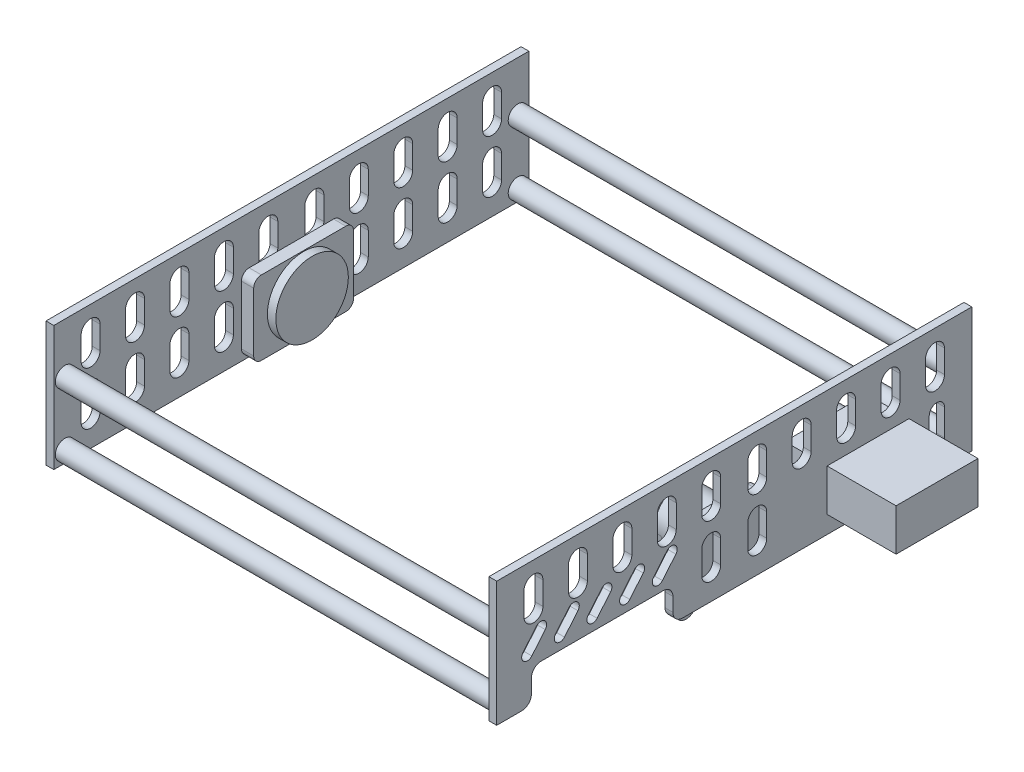
from build123d import *
from build123d.topology import SkipClean

# Parameters (mm, degrees)
SKETCH1_R             = 2.5019
BOSS_EXTRUDE1_DEPTH   = 115.316
BOSS_EXTRUDE1_2_DEPTH = 115.316
BOSS_EXTRUDE1_3_DEPTH = 115.316
BOSS_EXTRUDE1_4_DEPTH = 115.316
SKETCH5_W             = 123.698
SKETCH5_H             = 32.512
BOSS_EXTRUDE3_DEPTH   = 2.032
SKETCH6_W             = 21.329640996
SKETCH6_H             = 10.922
BOSS_EXTRUDE4_DEPTH   = 2.032
CUT_EXTRUDE1_DEPTH    = 2.032
BOSS_EXTRUDE5_DEPTH   = 3
SKETCH9_R             = 6.644818813
BOSS_EXTRUDE6_DEPTH   = 9
BOSS_EXTRUDE7_DEPTH   = 1.5
BOSS_EXTRUDE8_DEPTH   = 10.922
SKETCH13_R            = 4
BOSS_EXTRUDE9_DEPTH   = 0.7
SKETCH15_R            = 3.25
BOSS_EXTRUDE10_DEPTH  = 3.7
BOSS_EXTRUDE11_DEPTH  = 1.2
BOSS_EXTRUDE12_DEPTH  = 3.2
SKETCH17_R            = 9.44065
BOSS_EXTRUDE13_DEPTH  = 2.2


with BuildPart() as part:
    # Sketch1 → Boss-Extrude1 (new body)
    with BuildSketch(Plane(origin=(0, 0, 0), x_dir=(0, 0, -1), z_dir=(1, 0, 0))):
        with Locations(Location((0, 0, 0), (0, 0, 180))):
            Circle(SKETCH1_R)
    extrude(amount=BOSS_EXTRUDE1_DEPTH)



with BuildPart() as body_2:
    # Sketch1 → Boss-Extrude1 2 (new body)
    with BuildSketch(Plane(origin=(0, 0, 0), x_dir=(0, 0, -1), z_dir=(1, 0, 0))):
        with Locations(Location((0, -16.4338, 0), (0, 0, 180))):
            Circle(SKETCH1_R)
    extrude(amount=BOSS_EXTRUDE1_2_DEPTH)


with BuildPart() as body_3:
    # Sketch1 → Boss-Extrude1 3 (new body)
    with BuildSketch(Plane(origin=(0, 0, 0), x_dir=(0, 0, -1), z_dir=(1, 0, 0))):
        with Locations(Location((117.9322, -16.4338, 0), (0, 0, 180))):
            Circle(SKETCH1_R)
    extrude(amount=BOSS_EXTRUDE1_3_DEPTH)


with BuildPart() as body_4:
    # Sketch1 → Boss-Extrude1 4 (new body)
    with BuildSketch(Plane(origin=(0, 0, 0), x_dir=(0, 0, -1), z_dir=(1, 0, 0))):
        with Locations(Location((117.9322, 0, 0), (0, 0, 180))):
            Circle(SKETCH1_R)
    extrude(amount=BOSS_EXTRUDE1_4_DEPTH)


with BuildPart() as part_1:
    add(part.part)

    add(body_2.part)  # Boss-Extrude3 merges body 2

    add(body_3.part)  # Boss-Extrude3 merges body 3

    add(body_4.part)  # Boss-Extrude3 merges body 4
    # Sketch5 → Boss-Extrude3 (add)
    with BuildSketch(Plane(origin=(0, 0, 0), x_dir=(0, 0, -1), z_dir=(1, 0, 0))):
        with Locations((58.9661, -3.302)):
            Rectangle(SKETCH5_W, SKETCH5_H)
        with BuildLine():
            Line((67.4231, 1.2458), (67.4231, 7.2378))
            ThreePointArc((67.4231, 7.2378), (64.9581, 9.7028), (62.4931, 7.2378))
            Line((62.4931, 7.2378), (62.4931, 1.2458))
            ThreePointArc((62.4931, 1.2458), (64.9581, -1.2192), (67.4231, 1.2458))
        make_face(mode=Mode.SUBTRACT)
        with BuildLine():
            Line((67.4231, -12.5337), (67.4231, -6.5417))
            ThreePointArc((67.4231, -6.5417), (64.9581, -4.0767), (62.4931, -6.5417))
            Line((62.4931, -6.5417), (62.4931, -12.5337))
            ThreePointArc((62.4931, -12.5337), (64.9581, -14.9987), (67.4231, -12.5337))
        make_face(mode=Mode.SUBTRACT)
        with BuildLine():
            Line((78.9931, -12.5337), (78.9931, -6.5417))
            ThreePointArc((78.9931, -6.5417), (76.5281, -4.0767), (74.0631, -6.5417))
            Line((74.0631, -6.5417), (74.0631, -12.5337))
            ThreePointArc((74.0631, -12.5337), (76.5281, -14.9987), (78.9931, -12.5337))
        make_face(mode=Mode.SUBTRACT)
        with BuildLine():
            Line((4.2291, 1.2458), (4.2291, 7.2378))
            ThreePointArc((4.2291, 7.2378), (6.6941, 9.7028), (9.1591, 7.2378))
            Line((9.1591, 7.2378), (9.1591, 1.2458))
            ThreePointArc((9.1591, 1.2458), (6.6941, -1.2192), (4.2291, 1.2458))
        make_face(mode=Mode.SUBTRACT)
        with BuildLine():
            Line((15.7991, 1.2458), (15.7991, 7.2378))
            ThreePointArc((15.7991, 7.2378), (18.2641, 9.7028), (20.7291, 7.2378))
            Line((20.7291, 7.2378), (20.7291, 1.2458))
            ThreePointArc((20.7291, 1.2458), (18.2641, -1.2192), (15.7991, 1.2458))
        make_face(mode=Mode.SUBTRACT)
        with BuildLine():
            Line((27.3691, 1.2458), (27.3691, 7.2378))
            ThreePointArc((27.3691, 7.2378), (29.8341, 9.7028), (32.2991, 7.2378))
            Line((32.2991, 7.2378), (32.2991, 1.2458))
            ThreePointArc((32.2991, 1.2458), (29.8341, -1.2192), (27.3691, 1.2458))
        make_face(mode=Mode.SUBTRACT)
        with BuildLine():
            Line((38.9391, 1.2458), (38.9391, 7.2378))
            ThreePointArc((38.9391, 7.2378), (41.4041, 9.7028), (43.8691, 7.2378))
            Line((43.8691, 7.2378), (43.8691, 1.2458))
            ThreePointArc((43.8691, 1.2458), (41.4041, -1.2192), (38.9391, 1.2458))
        make_face(mode=Mode.SUBTRACT)
        with BuildLine():
            Line((50.5091, 1.2458), (50.5091, 7.2378))
            ThreePointArc((50.5091, 7.2378), (52.9741, 9.7028), (55.4391, 7.2378))
            Line((55.4391, 7.2378), (55.4391, 1.2458))
            ThreePointArc((55.4391, 1.2458), (52.9741, -1.2192), (50.5091, 1.2458))
        make_face(mode=Mode.SUBTRACT)
        with BuildLine():
            Line((15.7991, -12.5337), (15.7991, -6.5417))
            ThreePointArc((15.7991, -6.5417), (18.2641, -4.0767), (20.7291, -6.5417))
            Line((20.7291, -6.5417), (20.7291, -12.5337))
            ThreePointArc((20.7291, -12.5337), (18.2641, -14.9987), (15.7991, -12.5337))
        make_face(mode=Mode.SUBTRACT)
        with BuildLine():
            Line((27.3691, -12.5337), (27.3691, -6.5417))
            ThreePointArc((27.3691, -6.5417), (29.8341, -4.0767), (32.2991, -6.5417))
            Line((32.2991, -6.5417), (32.2991, -12.5337))
            ThreePointArc((32.2991, -12.5337), (29.8341, -14.9987), (27.3691, -12.5337))
        make_face(mode=Mode.SUBTRACT)
        with BuildLine():
            Line((38.9391, -12.5337), (38.9391, -6.5417))
            ThreePointArc((38.9391, -6.5417), (41.4041, -4.0767), (43.8691, -6.5417))
            Line((43.8691, -6.5417), (43.8691, -12.5337))
            ThreePointArc((43.8691, -12.5337), (41.4041, -14.9987), (38.9391, -12.5337))
        make_face(mode=Mode.SUBTRACT)
        with BuildLine():
            Line((50.5091, -12.5337), (50.5091, -6.5417))
            ThreePointArc((50.5091, -6.5417), (52.9741, -4.0767), (55.4391, -6.5417))
            Line((55.4391, -6.5417), (55.4391, -12.5337))
            ThreePointArc((55.4391, -12.5337), (52.9741, -14.9987), (50.5091, -12.5337))
        make_face(mode=Mode.SUBTRACT)
        with BuildLine():
            Line((4.2291, -12.5337), (4.2291, -6.5417))
            ThreePointArc((4.2291, -6.5417), (6.6941, -4.0767), (9.1591, -6.5417))
            Line((9.1591, -6.5417), (9.1591, -12.5337))
            ThreePointArc((9.1591, -12.5337), (6.6941, -14.9987), (4.2291, -12.5337))
        make_face(mode=Mode.SUBTRACT)
        with BuildLine():
            Line((78.9931, 1.2458), (78.9931, 7.2378))
            ThreePointArc((78.9931, 7.2378), (76.5281, 9.7028), (74.0631, 7.2378))
            Line((74.0631, 7.2378), (74.0631, 1.2458))
            ThreePointArc((74.0631, 1.2458), (76.5281, -1.2192), (78.9931, 1.2458))
        make_face(mode=Mode.SUBTRACT)
        with BuildLine():
            Line((90.5631, 1.2458), (90.5631, 7.2378))
            ThreePointArc((90.5631, 7.2378), (88.0981, 9.7028), (85.6331, 7.2378))
            Line((85.6331, 7.2378), (85.6331, 1.2458))
            ThreePointArc((85.6331, 1.2458), (88.0981, -1.2192), (90.5631, 1.2458))
        make_face(mode=Mode.SUBTRACT)
        with BuildLine():
            Line((90.5631, -12.5337), (90.5631, -6.5417))
            ThreePointArc((90.5631, -6.5417), (88.0981, -4.0767), (85.6331, -6.5417))
            Line((85.6331, -6.5417), (85.6331, -12.5337))
            ThreePointArc((85.6331, -12.5337), (88.0981, -14.9987), (90.5631, -12.5337))
        make_face(mode=Mode.SUBTRACT)
        with BuildLine():
            Line((102.1331, -12.5337), (102.1331, -6.5417))
            ThreePointArc((102.1331, -6.5417), (99.6681, -4.0767), (97.2031, -6.5417))
            Line((97.2031, -6.5417), (97.2031, -12.5337))
            ThreePointArc((97.2031, -12.5337), (99.6681, -14.9987), (102.1331, -12.5337))
        make_face(mode=Mode.SUBTRACT)
        with BuildLine():
            Line((102.1331, 1.2458), (102.1331, 7.2378))
            ThreePointArc((102.1331, 7.2378), (99.6681, 9.7028), (97.2031, 7.2378))
            Line((97.2031, 7.2378), (97.2031, 1.2458))
            ThreePointArc((97.2031, 1.2458), (99.6681, -1.2192), (102.1331, 1.2458))
        make_face(mode=Mode.SUBTRACT)
        with BuildLine():
            Line((113.7031, 1.2458), (113.7031, 7.2378))
            ThreePointArc((113.7031, 7.2378), (111.2381, 9.7028), (108.7731, 7.2378))
            Line((108.7731, 7.2378), (108.7731, 1.2458))
            ThreePointArc((108.7731, 1.2458), (111.2381, -1.2192), (113.7031, 1.2458))
        make_face(mode=Mode.SUBTRACT)
        with BuildLine():
            Line((113.7031, -12.5337), (113.7031, -6.5417))
            ThreePointArc((113.7031, -6.5417), (111.2381, -4.0767), (108.7731, -6.5417))
            Line((108.7731, -6.5417), (108.7731, -12.5337))
            ThreePointArc((108.7731, -12.5337), (111.2381, -14.9987), (113.7031, -12.5337))
        make_face(mode=Mode.SUBTRACT)
    extrude(amount=BOSS_EXTRUDE3_DEPTH)



with BuildPart() as body_2_2:
    # Sketch6 → Boss-Extrude4 (new body)
    with BuildSketch(Plane(origin=(115.316, 0, 0), x_dir=(0, 0, -1), z_dir=(1, 0, 0))):
        with BuildLine():
            Line((-2.8829, -19.558), (3.6195, -19.558))
            ThreePointArc((3.6195, -19.558), (5.415551224, -18.814051224), (6.1595, -17.018))
            Line((6.1595, -17.018), (6.1595, -13.4112))
            ThreePointArc((6.1595, -13.4112), (6.903448776, -11.615148776), (8.6995, -10.8712))
            Line((8.6995, -10.8712), (40.4495, -10.8712))
            ThreePointArc((40.4495, -10.8712), (42.245551224, -11.615148776), (42.9895, -13.4112))
            Line((42.9895, -13.4112), (42.9895, -17.018))
            ThreePointArc((42.9895, -17.018), (43.733448776, -18.814051224), (45.5295, -19.558))
            Line((45.5295, -19.558), (120.8151, -19.558))
            Line((120.8151, -19.558), (120.8151, 12.954))
            Line((120.8151, 12.954), (-2.8829, 12.954))
            Line((-2.8829, 12.954), (-2.8829, -19.558))
        make_face()
        with BuildLine():
            Line((55.4391, -6.5417), (55.4391, -12.5337))
            ThreePointArc((55.4391, -12.5337), (52.9741, -14.9987), (50.5091, -12.5337))
            Line((50.5091, -12.5337), (50.5091, -6.5417))
            ThreePointArc((50.5091, -6.5417), (52.9741, -4.0767), (55.4391, -6.5417))
        make_face(mode=Mode.SUBTRACT)
        with BuildLine():
            Line((67.4231, -6.5417), (67.4231, -12.5337))
            ThreePointArc((67.4231, -12.5337), (64.9581, -14.9987), (62.4931, -12.5337))
            Line((62.4931, -12.5337), (62.4931, -6.5417))
            ThreePointArc((62.4931, -6.5417), (64.9581, -4.0767), (67.4231, -6.5417))
        make_face(mode=Mode.SUBTRACT)
        with BuildLine():
            Line((113.7031, -6.060570834), (113.7031, -13.014829166))
            ThreePointArc((113.7031, -13.014829166), (111.719229166, -14.9987), (109.735358331, -13.014829166))
            Line((109.735358331, -13.014829166), (109.735358331, -6.060570834))
            ThreePointArc((109.735358331, -6.060570834), (111.719229166, -4.0767), (113.7031, -6.060570834))
        make_face(mode=Mode.SUBTRACT)
        with Locations((93.800974107, -9.5377)):
            Rectangle(SKETCH6_W, SKETCH6_H, mode=Mode.SUBTRACT)
        with BuildLine():
            Line((15.7991, 7.2378), (15.7991, 1.2458))
            ThreePointArc((15.7991, 1.2458), (18.2641, -1.2192), (20.7291, 1.2458))
            Line((20.7291, 1.2458), (20.7291, 7.2378))
            ThreePointArc((20.7291, 7.2378), (18.2641, 9.7028), (15.7991, 7.2378))
        make_face(mode=Mode.SUBTRACT)
        with BuildLine():
            Line((9.1591, 1.2458), (9.1591, 7.2378))
            ThreePointArc((9.1591, 7.2378), (6.6941, 9.7028), (4.2291, 7.2378))
            Line((4.2291, 7.2378), (4.2291, 1.2458))
            ThreePointArc((4.2291, 1.2458), (6.6941, -1.2192), (9.1591, 1.2458))
        make_face(mode=Mode.SUBTRACT)
        with BuildLine():
            Line((27.3691, 7.2378), (27.3691, 1.2458))
            ThreePointArc((27.3691, 1.2458), (29.8341, -1.2192), (32.2991, 1.2458))
            Line((32.2991, 1.2458), (32.2991, 7.2378))
            ThreePointArc((32.2991, 7.2378), (29.8341, 9.7028), (27.3691, 7.2378))
        make_face(mode=Mode.SUBTRACT)
        with BuildLine():
            Line((38.9391, 7.2378), (38.9391, 1.2458))
            ThreePointArc((38.9391, 1.2458), (41.4041, -1.2192), (43.8691, 1.2458))
            Line((43.8691, 1.2458), (43.8691, 7.2378))
            ThreePointArc((43.8691, 7.2378), (41.4041, 9.7028), (38.9391, 7.2378))
        make_face(mode=Mode.SUBTRACT)
        with BuildLine():
            Line((50.5091, 7.2378), (50.5091, 1.2458))
            ThreePointArc((50.5091, 1.2458), (52.9741, -1.2192), (55.4391, 1.2458))
            Line((55.4391, 1.2458), (55.4391, 7.2378))
            ThreePointArc((55.4391, 7.2378), (52.9741, 9.7028), (50.5091, 7.2378))
        make_face(mode=Mode.SUBTRACT)
        with BuildLine():
            Line((62.4931, 1.2458), (62.4931, 7.2378))
            ThreePointArc((62.4931, 7.2378), (64.9581, 9.7028), (67.4231, 7.2378))
            Line((67.4231, 7.2378), (67.4231, 1.2458))
            ThreePointArc((67.4231, 1.2458), (64.9581, -1.2192), (62.4931, 1.2458))
        make_face(mode=Mode.SUBTRACT)
        with BuildLine():
            Line((74.0631, 1.2458), (74.0631, 7.2378))
            ThreePointArc((74.0631, 7.2378), (76.5281, 9.7028), (78.9931, 7.2378))
            Line((78.9931, 7.2378), (78.9931, 1.2458))
            ThreePointArc((78.9931, 1.2458), (76.5281, -1.2192), (74.0631, 1.2458))
        make_face(mode=Mode.SUBTRACT)
        with BuildLine():
            Line((85.6331, 1.2458), (85.6331, 7.2378))
            ThreePointArc((85.6331, 7.2378), (88.0981, 9.7028), (90.5631, 7.2378))
            Line((90.5631, 7.2378), (90.5631, 1.2458))
            ThreePointArc((90.5631, 1.2458), (88.0981, -1.2192), (85.6331, 1.2458))
        make_face(mode=Mode.SUBTRACT)
        with BuildLine():
            Line((97.2031, 1.2458), (97.2031, 7.2378))
            ThreePointArc((97.2031, 7.2378), (99.6681, 9.7028), (102.1331, 7.2378))
            Line((102.1331, 7.2378), (102.1331, 1.2458))
            ThreePointArc((102.1331, 1.2458), (99.6681, -1.2192), (97.2031, 1.2458))
        make_face(mode=Mode.SUBTRACT)
        with BuildLine():
            Line((113.7031, 7.2378), (113.7031, 1.2458))
            ThreePointArc((113.7031, 1.2458), (111.2381, -1.2192), (108.7731, 1.2458))
            Line((108.7731, 1.2458), (108.7731, 7.2378))
            ThreePointArc((108.7731, 7.2378), (111.2381, 9.7028), (113.7031, 7.2378))
        make_face(mode=Mode.SUBTRACT)
    extrude(amount=BOSS_EXTRUDE4_DEPTH)

    # Sketch7 → Cut-Extrude1 (cut)
    with BuildSketch(Plane(origin=(117.348, 0, 0), x_dir=(0, 0, -1), z_dir=(1, 0, 0))):
        with BuildLine():
            Line((3.965308361, -6.560275435), (7.465308361, -2.365075435))
            ThreePointArc((7.465308361, -2.365075435), (9.578024565, -2.174208361), (9.768891639, -4.286924565))
            Line((9.768891639, -4.286924565), (6.268891639, -8.482124565))
            ThreePointArc((6.268891639, -8.482124565), (4.156175435, -8.672991639), (3.965308361, -6.560275435))
        make_face()
        with BuildLine():
            Line((12.465308361, -6.560275435), (15.965308361, -2.365075435))
            ThreePointArc((15.965308361, -2.365075435), (18.078024565, -2.174208361), (18.268891639, -4.286924565))
            Line((18.268891639, -4.286924565), (14.768891639, -8.482124565))
            ThreePointArc((14.768891639, -8.482124565), (12.656175435, -8.672991639), (12.465308361, -6.560275435))
        make_face()
        with BuildLine():
            Line((20.965308361, -6.560275435), (24.465308361, -2.365075435))
            ThreePointArc((24.465308361, -2.365075435), (26.578024565, -2.174208361), (26.768891639, -4.286924565))
            Line((26.768891639, -4.286924565), (23.268891639, -8.482124565))
            ThreePointArc((23.268891639, -8.482124565), (21.156175435, -8.672991639), (20.965308361, -6.560275435))
        make_face()
        with BuildLine():
            Line((29.465308361, -6.560275435), (32.965308361, -2.365075435))
            ThreePointArc((32.965308361, -2.365075435), (35.078024565, -2.174208361), (35.268891639, -4.286924565))
            Line((35.268891639, -4.286924565), (31.768891639, -8.482124565))
            ThreePointArc((31.768891639, -8.482124565), (29.656175435, -8.672991639), (29.465308361, -6.560275435))
        make_face()
        with BuildLine():
            Line((37.965308361, -6.560275435), (41.465308361, -2.365075435))
            ThreePointArc((41.465308361, -2.365075435), (43.578024565, -2.174208361), (43.768891639, -4.286924565))
            Line((43.768891639, -4.286924565), (40.268891639, -8.482124565))
            ThreePointArc((40.268891639, -8.482124565), (38.156175435, -8.672991639), (37.965308361, -6.560275435))
        make_face()
    extrude(amount=-CUT_EXTRUDE1_DEPTH, mode=Mode.SUBTRACT)


with BuildPart() as part_2:
    add(part_1.part)

    add(body_2_2.part)  # Boss-Extrude5 merges body 2 2
    # Sketch8 → Boss-Extrude5 (add)
    with BuildSketch(Plane.ZY.offset(-115.316)):
        with BuildLine():
            Line((-67.351308674, -16.382518813), (-50.580891326, -16.382518813))
            ThreePointArc((-50.580891326, -16.382518813), (-49.166677764, -15.796732376), (-48.580891326, -14.382518813))
            Line((-48.580891326, -14.382518813), (-48.580891326, -4.692881187))
            ThreePointArc((-48.580891326, -4.692881187), (-49.166677764, -3.278667624), (-50.580891326, -2.692881187))
            Line((-50.580891326, -2.692881187), (-67.351308674, -2.692881187))
            ThreePointArc((-67.351308674, -2.692881187), (-68.765522236, -3.278667624), (-69.351308674, -4.692881187))
            Line((-69.351308674, -4.692881187), (-69.351308674, -14.382518813))
            ThreePointArc((-69.351308674, -14.382518813), (-68.765522236, -15.796732376), (-67.351308674, -16.382518813))
        make_face()
    extrude(amount=BOSS_EXTRUDE5_DEPTH)

    # Sketch9 → Boss-Extrude6 (add)
    with BuildSketch(Plane.ZY.offset(-112.316)):
        with Locations((-58.9661, -9.5377)):
            Circle(SKETCH9_R)
    extrude(amount=BOSS_EXTRUDE6_DEPTH)

    # Sketch10 → Boss-Extrude7 (add)
    with BuildSketch(Plane.ZY.offset(-103.316)):
        with BuildLine():
            Line((-65.487632482, -10.811760887), (-61.616004865, -30.629452113))
            ThreePointArc((-61.616004865, -30.629452113), (-58.9661, -32.811760887), (-56.316195135, -30.629452113))
            Line((-56.316195135, -30.629452113), (-52.444567518, -10.811760887))
            Line((-52.444567518, -10.811760887), (-65.487632482, -10.811760887))
        make_face()
    extrude(amount=-BOSS_EXTRUDE7_DEPTH)

    # Sketch12 → Boss-Extrude8 (add)
    with BuildSketch(Plane.XZ.offset(4.0767)):
        Polygon((115.316, -83.136153609), (115.316, -80.836153609), (113.616, -80.836153609), (113.616, -83.136153609), (106.316, -83.136153609), (106.316, -104.465794605), (113.616, -104.465794605), (113.616, -106.765794605), (115.316, -106.765794605), (115.316, -104.465794605), (135.316, -104.465794605), (135.316, -83.136153609), align=None)
    extrude(amount=BOSS_EXTRUDE8_DEPTH)

    # Sketch13 → Boss-Extrude9 (add)
    with BuildSketch(Plane.ZY.offset(-106.316)):
        with Locations(Location((-99.765794605, -9.5377, 0), (0, 0, 180))):
            Circle(SKETCH13_R)
    extrude(amount=BOSS_EXTRUDE9_DEPTH)

    # Sketch15 → Boss-Extrude10 (add)
    with BuildSketch(Plane.ZY.offset(-105.616)):
        with Locations((-99.765794605, -9.5377)):
            Circle(SKETCH15_R)
    extrude(amount=BOSS_EXTRUDE10_DEPTH)

    # Sketch14 → Boss-Extrude11 (add)
    with SkipClean():  # the faces are left unmerged after this step: merging them gives an invalid solid
        with BuildSketch(Plane.ZY.offset(-101.916)):
            with BuildLine():
                Line((-102.06290993, -28.626918102), (-103.011718434, -9.700422151))
                ThreePointArc((-103.011718434, -9.700422151), (-99.765794605, -6.2877), (-96.519870777, -9.700422151))
                Line((-96.519870777, -9.700422151), (-97.468679281, -28.626918102))
                ThreePointArc((-97.468679281, -28.626918102), (-99.765794605, -30.811760887), (-102.06290993, -28.626918102))
            make_face()
        extrude(amount=BOSS_EXTRUDE11_DEPTH)

    # Sketch16 → Boss-Extrude12 (add)
    with SkipClean():  # the faces are left unmerged after this step: merging them gives an invalid solid
        with BuildSketch(Plane(origin=(2.032, 0, 0), x_dir=(0, 0, -1), z_dir=(1, 0, 0))):
            with BuildLine():
                Line((47.9661, -18.758), (69.9661, -18.758))
                ThreePointArc((69.9661, -18.758), (71.380313562, -18.172213562), (71.9661, -16.758))
                Line((71.9661, -16.758), (71.9661, -1.4767))
                ThreePointArc((71.9661, -1.4767), (71.380313562, -0.062486438), (69.9661, 0.5233))
                Line((69.9661, 0.5233), (47.9661, 0.5233))
                ThreePointArc((47.9661, 0.5233), (46.551886438, -0.062486438), (45.9661, -1.4767))
                Line((45.9661, -1.4767), (45.9661, -16.758))
                ThreePointArc((45.9661, -16.758), (46.551886438, -18.172213562), (47.9661, -18.758))
            make_face()
        extrude(amount=BOSS_EXTRUDE12_DEPTH)

    # Sketch17 → Boss-Extrude13 (add)
    with SkipClean():  # the faces are left unmerged after this step: merging them gives an invalid solid
        with BuildSketch(Plane(origin=(5.232, 0, 0), x_dir=(0, 0, -1), z_dir=(1, 0, 0))):
            with Locations((58.9661, -9.11735)):
                Circle(SKETCH17_R)
        extrude(amount=BOSS_EXTRUDE13_DEPTH)


solid = part_2.part
